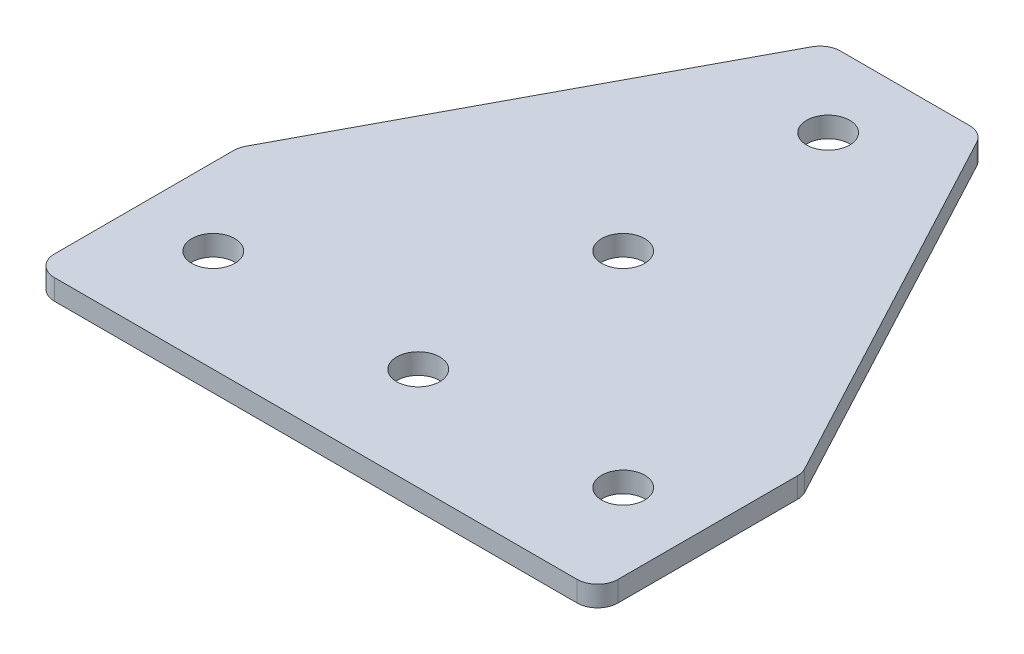
from build123d import *

# Parameters (mm, degrees)
SKETCH_1_R      = 2.1
EXTRUDE_1_DEPTH = 2
FILLET_1_R      = 2


with BuildPart() as part:
    # ｽｹｯﾁ1 → ﾎﾞｽ - 押し出し1 (new body)
    with BuildSketch(Plane(origin=(0, 0, 0), x_dir=(1, 0, 0), z_dir=(0, 1, 0))):
        Polygon((0, 0), (55, 0), (55, 20), (35, 57.5), (20, 57.5), (0, 20), align=None)
        with Locations(Location((7.5, 10, 0), (0, 0, 270))):
            Circle(SKETCH_1_R, mode=Mode.SUBTRACT)
        with Locations(Location((47.5, 10, 0), (0, 0, 90))):
            Circle(SKETCH_1_R, mode=Mode.SUBTRACT)
        with Locations(Location((27.5, 10, 0), (0, 0, 270))):
            Circle(SKETCH_1_R, mode=Mode.SUBTRACT)
        with Locations(Location((27.5, 50, 0), (0, 0, 270))):
            Circle(SKETCH_1_R, mode=Mode.SUBTRACT)
        with Locations(Location((27.5, 30, 0), (0, 0, 270))):
            Circle(SKETCH_1_R, mode=Mode.SUBTRACT)
    extrude(amount=EXTRUDE_1_DEPTH)

    # ﾌｨﾚｯﾄ1
    fillet_1_edges = [part.edges().sort_by_distance(p)[0] for p in [
        (0, 1, -20),
        (20, 1, -57.5),
        (35, 1, -57.5),
        (55, 1, -20),
        (55, 1, 0),
        (0, 1, 0),
    ]]
    fillet(fillet_1_edges, radius=FILLET_1_R)


solid = part.part
